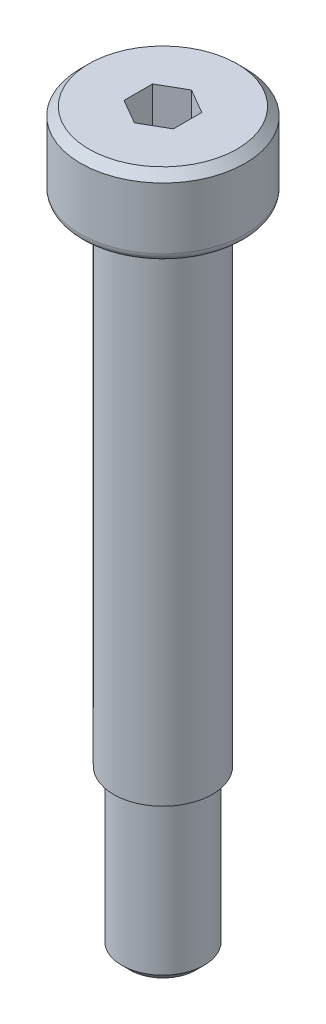
from build123d import *

# Parameters (mm, degrees)
CUT_EXTRUDE1_DEPTH = 2.4
CHAMFER1_SIZE      = 0.5
FILLET1_R          = 0.5
CHAMFER2_SIZE      = 0.5


with BuildPart() as part:
    # Sketch1 → Revolve1 (revolve)
    with BuildSketch(Plane.XY, mode=Mode.PRIVATE) as revolve1_sk:
        Polygon((0, 0), (5, 0), (5, -4.73), (2.75, -4.73), (2.75, -5.23), (3, -5.23), (3, -34.73), (2.5, -34.73), (2.5, -44.48), (0, -44.48), align=None)
    revolve(revolve1_sk.sketch.rotate(Axis((0, 5, 0), (0, -1, 0)), 180), axis=Axis((0, 5, 0), (0, -1, 0)))

    # Sketch2 → Cut-Extrude1 (cut)
    with BuildSketch(Plane(origin=(0, 0, 0), x_dir=(1, 0, 0), z_dir=(0, 1, 0))):
        Polygon((0, -1.732050808), (1.5, -0.866025404), (1.5, 0.866025404), (0, 1.732050808), (-1.5, 0.866025404), (-1.5, -0.866025404), align=None)
    extrude(amount=-CUT_EXTRUDE1_DEPTH, mode=Mode.SUBTRACT)

    # Chamfer1
    chamfer1_edges = [part.edges().sort_by_distance(p)[0] for p in [
        (5, 0, 0),
    ]]
    chamfer(chamfer1_edges, length=CHAMFER1_SIZE)

    # Fillet1
    fillet1_edges = [part.edges().sort_by_distance(p)[0] for p in [
        (5, -4.73, 0),
    ]]
    fillet(fillet1_edges, radius=FILLET1_R)

    # Chamfer2
    chamfer2_edges = [part.edges().sort_by_distance(p)[0] for p in [
        (2.5, -44.48, 0),
    ]]
    chamfer(chamfer2_edges, length=CHAMFER2_SIZE)


solid = part.part
